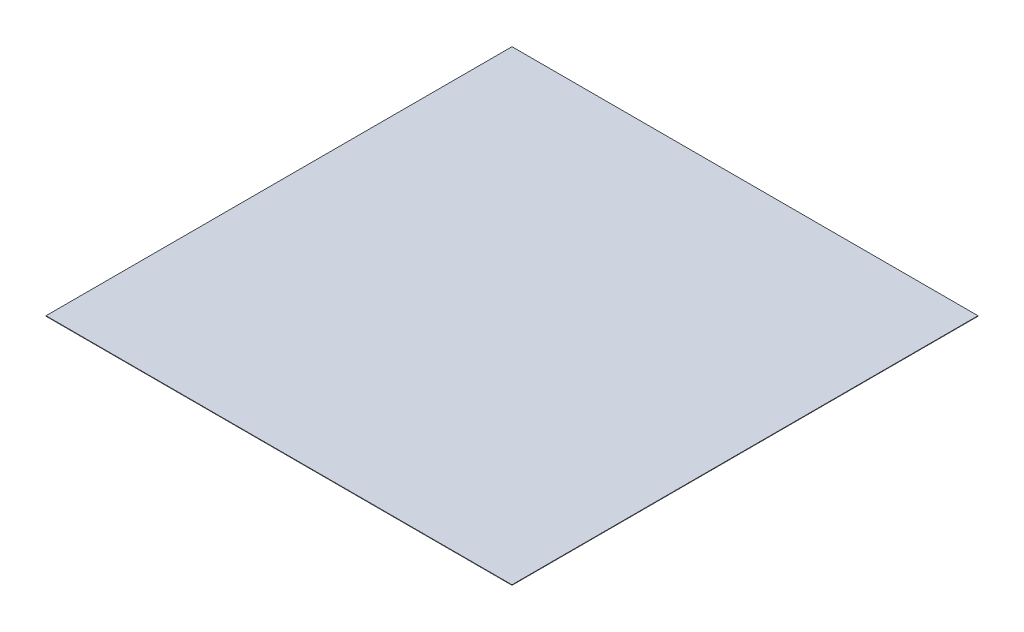
from build123d import *

# Parameters (mm, degrees)
SKETCH1_W           = 203.2
SKETCH1_H           = 203.2
BOSS_EXTRUDE1_DEPTH = 0.2032


with BuildPart() as part:
    # Sketch1 → Boss-Extrude1 (new body)
    with BuildSketch(Plane(origin=(0, 0, 0), x_dir=(1, 0, 0), z_dir=(0, 1, 0))):
        Rectangle(SKETCH1_W, SKETCH1_H)
    extrude(amount=BOSS_EXTRUDE1_DEPTH)


solid = part.part
